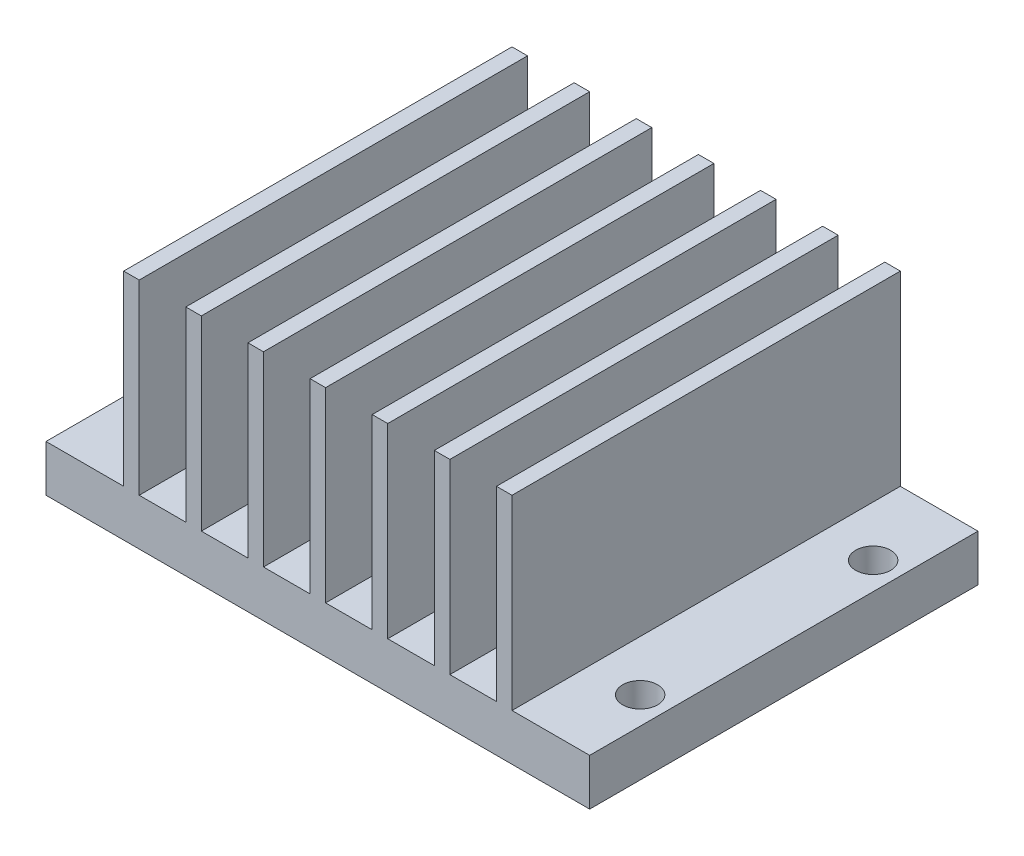
from build123d import *

# Parameters (mm, degrees)
SKETCH_1_W          = 70
SKETCH_1_H          = 50
EXTRUDE_1_DEPTH     = 6
SKETCH_2_W          = 2
SKETCH_2_H          = 50
EXTRUDE_2_DEPTH     = 24.5
SKETCH_3_R          = 2.25
CUT_EXTRUDE_1_DEPTH = 53.440442409


with BuildPart() as part:
    # 草图1 → 凸台-拉伸1 (new body)
    with BuildSketch(Plane(origin=(0, 0, 0), x_dir=(1, 0, 0), z_dir=(0, 1, 0))):
        Rectangle(SKETCH_1_W, SKETCH_1_H)
    extrude(amount=EXTRUDE_1_DEPTH)

    # 草图2 → 凸台-拉伸2 (add)
    with BuildSketch(Plane(origin=(0, 5.5, 0), x_dir=(1, 0, 0), z_dir=(0, 1, 0))):
        with Locations((-24, 0)):
            Rectangle(SKETCH_2_W, SKETCH_2_H)
        with Locations((-16, 0)):
            Rectangle(SKETCH_2_W, SKETCH_2_H)
        with Locations((-8, 0)):
            Rectangle(SKETCH_2_W, SKETCH_2_H)
        Rectangle(SKETCH_2_W, SKETCH_2_H)
        with Locations((8, 0)):
            Rectangle(SKETCH_2_W, SKETCH_2_H)
        with Locations((16, 0)):
            Rectangle(SKETCH_2_W, SKETCH_2_H)
        with Locations((24, 0)):
            Rectangle(SKETCH_2_W, SKETCH_2_H)
    extrude(amount=EXTRUDE_2_DEPTH)

    # 草图3 → 切除-拉伸1 (cut, through all)
    with BuildSketch(Plane(origin=(0, 30, 0), x_dir=(1, 0, 0), z_dir=(0, 1, 0))):
        with Locations(Location((-31.5, 15, 0), (0, 0, 270))):
            Circle(SKETCH_3_R)
        with Locations(Location((-31.5, -15, 0), (0, 0, 270))):
            Circle(SKETCH_3_R)
        with Locations(Location((31.5, 15, 0), (0, 0, 270))):
            Circle(SKETCH_3_R)
        with Locations(Location((31.5, -15, 0), (0, 0, 270))):
            Circle(SKETCH_3_R)
    extrude(amount=-CUT_EXTRUDE_1_DEPTH, mode=Mode.SUBTRACT)


solid = part.part
